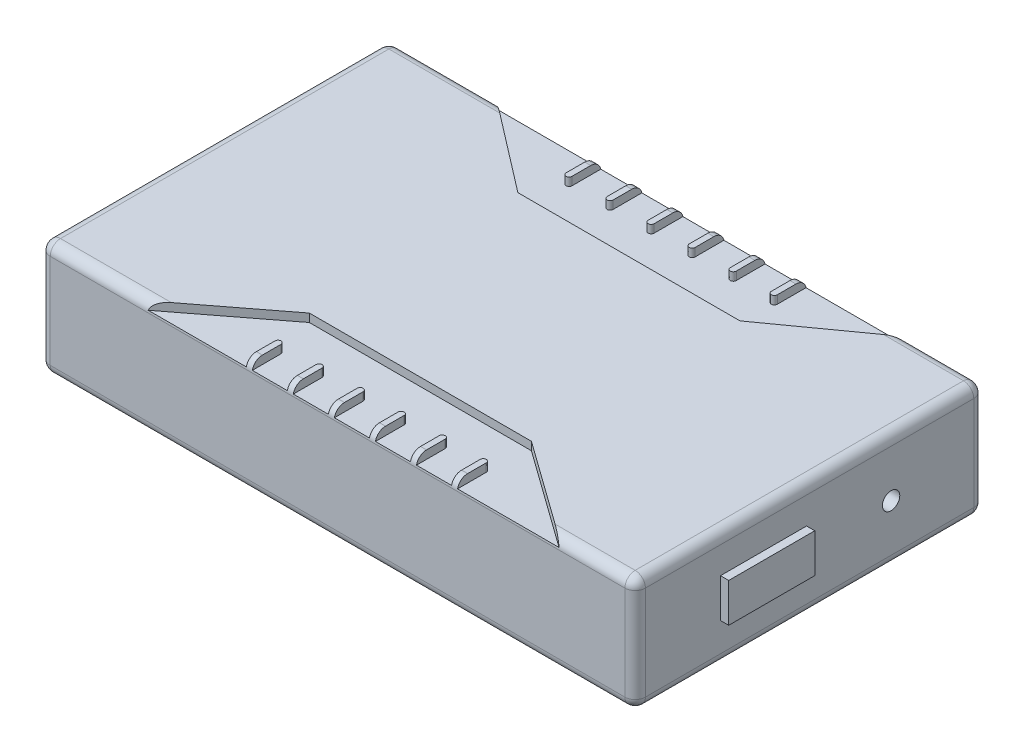
from build123d import *

# Parameters (mm, degrees)
SKETCH2_W           = 145
SKETCH2_H           = 85
BOSS_EXTRUDE1_DEPTH = 28
FILLET1_R           = 2.5
SKETCH3_R           = 2.115255866
CUT_EXTRUDE1_DEPTH  = 10
SKETCH4_W           = 20.962420857
SKETCH4_H           = 9.466899742
BOSS_EXTRUDE2_DEPTH = 2
CUT_EXTRUDE2_DEPTH  = 2


with BuildPart() as part:
    # Sketch2 → Boss-Extrude1 (new body)
    with BuildSketch(Plane(origin=(0, 0, 0), x_dir=(1, 0, 0), z_dir=(0, 1, 0))):
        with Locations((72.5, 42.5)):
            Rectangle(SKETCH2_W, SKETCH2_H)
    extrude(amount=BOSS_EXTRUDE1_DEPTH)

    # Fillet1
    fillet1_edges = [part.edges().sort_by_distance(p)[0] for p in [
        (145, 28, -42.5),
        (72.5, 28, -85),
        (0, 28, -42.5),
        (72.5, 0, -85),
        (145, 0, -42.5),
        (72.5, 0, 0),
        (0, 0, -42.5),
        (0, 14, -85),
        (145, 14, -85),
        (145, 14, 0),
        (0, 14, 0),
        (72.5, 28, 0),
    ]]
    fillet(fillet1_edges, radius=FILLET1_R)

    # Sketch3 → Cut-Extrude1 (cut)
    with BuildSketch(Plane(origin=(145, 0, 0), x_dir=(0, 0, -1), z_dir=(1, 0, 0))):
        with Locations((62.355900108, 14.02082484)):
            Circle(SKETCH3_R)
    extrude(amount=-CUT_EXTRUDE1_DEPTH, mode=Mode.SUBTRACT)

    # Sketch4 → Boss-Extrude2 (add)
    with BuildSketch(Plane(origin=(145, 0, 0), x_dir=(0, 0, -1), z_dir=(1, 0, 0))):
        with Locations((31.281109073, 14.236048875)):
            Rectangle(SKETCH4_W, SKETCH4_H)
    extrude(amount=BOSS_EXTRUDE2_DEPTH)

    # Sketch5 → Cut-Extrude2 (cut)
    with BuildSketch(Plane(origin=(0, 28, 0), x_dir=(1, 0, 0), z_dir=(0, 1, 0))):
        with BuildLine():
            Line((26.254495466, 85), (48.530276138, 67.90157817))
            Line((48.530276138, 67.90157817), (102.643480063, 67.90157817))
            Line((102.643480063, 67.90157817), (126.477007635, 85))
            Line((126.477007635, 85), (101.67856471, 85))
            Line((101.67856471, 85), (101.67856471, 77.955286257))
            ThreePointArc((101.67856471, 77.955286257), (100.949025715, 77.225747261), (100.21948672, 77.955286257))
            Line((100.21948672, 77.955286257), (100.21948672, 85))
            Line((100.21948672, 85), (91.67856471, 85))
            Line((91.67856471, 85), (91.67856471, 77.955286257))
            ThreePointArc((91.67856471, 77.955286257), (90.949025715, 77.225747261), (90.21948672, 77.955286257))
            Line((90.21948672, 77.955286257), (90.21948672, 85))
            Line((90.21948672, 85), (81.67856471, 85))
            Line((81.67856471, 85), (81.67856471, 77.955286257))
            ThreePointArc((81.67856471, 77.955286257), (80.949025715, 77.225747261), (80.21948672, 77.955286257))
            Line((80.21948672, 77.955286257), (80.21948672, 85))
            Line((80.21948672, 85), (71.67856471, 85))
            Line((71.67856471, 85), (71.67856471, 77.955286257))
            ThreePointArc((71.67856471, 77.955286257), (70.949025715, 77.225747261), (70.21948672, 77.955286257))
            Line((70.21948672, 77.955286257), (70.21948672, 85))
            Line((70.21948672, 85), (61.67856471, 85))
            Line((61.67856471, 85), (61.67856471, 77.955286257))
            ThreePointArc((61.67856471, 77.955286257), (60.949025715, 77.225747261), (60.21948672, 77.955286257))
            Line((60.21948672, 77.955286257), (60.21948672, 85))
            Line((60.21948672, 85), (51.67856471, 85))
            Line((51.67856471, 85), (51.67856471, 77.955286257))
            ThreePointArc((51.67856471, 77.955286257), (50.949025715, 77.225747261), (50.21948672, 77.955286257))
            Line((50.21948672, 77.955286257), (50.21948672, 85))
            Line((50.21948672, 85), (26.254495466, 85))
        make_face()
        with BuildLine():
            Line((101.67856471, 0), (126.477007635, 0))
            Line((126.477007635, 0), (102.643480063, 17.09842183))
            Line((102.643480063, 17.09842183), (48.530276138, 17.09842183))
            Line((48.530276138, 17.09842183), (26.254495466, 0))
            Line((26.254495466, 0), (50.21948672, 0))
            Line((50.21948672, 0), (50.21948672, 7.044713743))
            ThreePointArc((50.21948672, 7.044713743), (50.949025715, 7.774252739), (51.67856471, 7.044713743))
            Line((51.67856471, 7.044713743), (51.67856471, 0))
            Line((51.67856471, 0), (60.21948672, 0))
            Line((60.21948672, 0), (60.21948672, 7.044713743))
            ThreePointArc((60.21948672, 7.044713743), (60.949025715, 7.774252739), (61.67856471, 7.044713743))
            Line((61.67856471, 7.044713743), (61.67856471, 0))
            Line((61.67856471, 0), (70.21948672, 0))
            Line((70.21948672, 0), (70.21948672, 7.044713743))
            ThreePointArc((70.21948672, 7.044713743), (70.949025715, 7.774252739), (71.67856471, 7.044713743))
            Line((71.67856471, 7.044713743), (71.67856471, 0))
            Line((71.67856471, 0), (80.21948672, 0))
            Line((80.21948672, 0), (80.21948672, 7.044713743))
            ThreePointArc((80.21948672, 7.044713743), (80.949025715, 7.774252739), (81.67856471, 7.044713743))
            Line((81.67856471, 7.044713743), (81.67856471, 0))
            Line((81.67856471, 0), (90.21948672, 0))
            Line((90.21948672, 0), (90.21948672, 7.044713743))
            ThreePointArc((90.21948672, 7.044713743), (90.949025715, 7.774252739), (91.67856471, 7.044713743))
            Line((91.67856471, 7.044713743), (91.67856471, 0))
            Line((91.67856471, 0), (100.21948672, 0))
            Line((100.21948672, 0), (100.21948672, 7.044713743))
            ThreePointArc((100.21948672, 7.044713743), (100.949025715, 7.774252739), (101.67856471, 7.044713743))
            Line((101.67856471, 7.044713743), (101.67856471, 0))
        make_face()
    extrude(amount=-CUT_EXTRUDE2_DEPTH, mode=Mode.SUBTRACT)


solid = part.part
